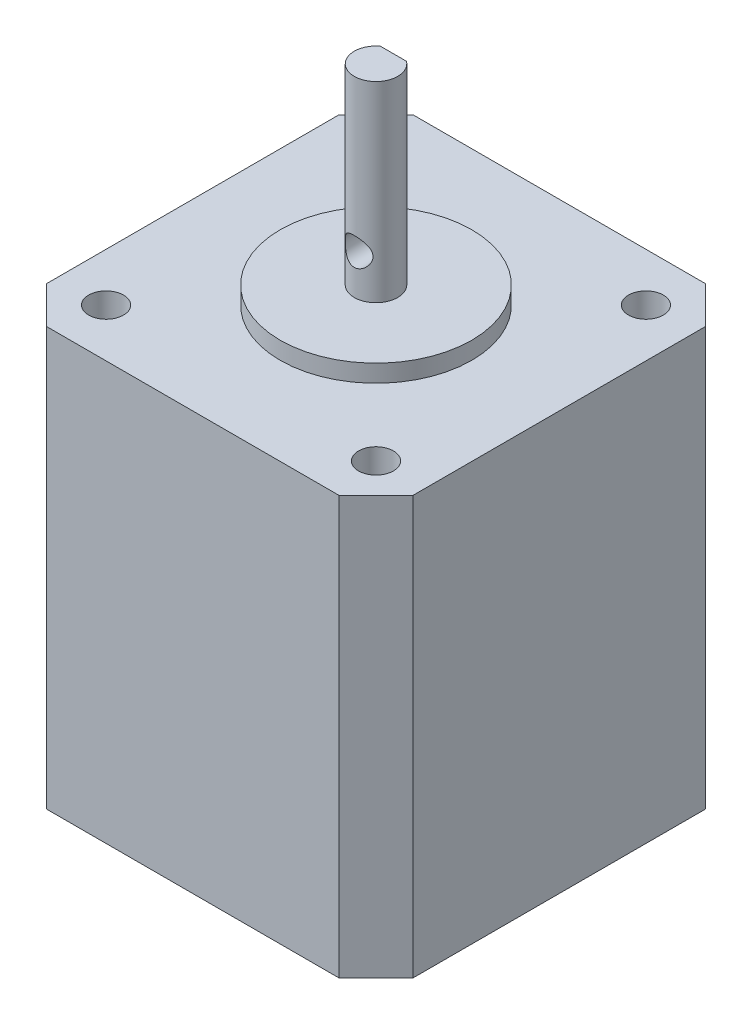
from build123d import *

# Parameters (mm, degrees)
BOSS_EXTRUDE1_DEPTH = 48
SKETCH2_R           = 2
CUT_EXTRUDE1_DEPTH  = 48
SKETCH3_R           = 11
BOSS_EXTRUDE2_DEPTH = 2
SKETCH4_R           = 2.5
BOSS_EXTRUDE3_DEPTH = 22
CUT_EXTRUDE2_START  = -15
CUT_EXTRUDE2_DEPTH  = 15
SKETCH6_R           = 1.5875
CUT_EXTRUDE5_DEPTH  = 79.623819546
BOSS_EXTRUDE4_START = 10
SKETCH7_R           = 2.5
BOSS_EXTRUDE4_DEPTH = 10
SKETCH8_R           = 0.75
CUT_EXTRUDE6_DEPTH  = 10


with BuildPart() as part:
    # Sketch1 → Boss-Extrude1 (new body)
    with BuildSketch(Plane(origin=(0, 0, 0), x_dir=(1, 0, 0), z_dir=(0, 1, 0))):
        Polygon((16.807359313, -21.05), (21.05, -16.807359313), (21.05, 16.807359313), (16.807359313, 21.05), (-16.807359313, 21.05), (-21.05, 16.807359313), (-21.05, -16.807359313), (-16.807359313, -21.05), align=None)
    extrude(amount=BOSS_EXTRUDE1_DEPTH)

    # Sketch2 → Cut-Extrude1 (cut)
    with BuildSketch(Plane(origin=(0, 48, 0), x_dir=(1, 0, 0), z_dir=(0, 1, 0))):
        with Locations(Location((-15.5, 15.5, 0), (0, 0, 270))):
            Circle(SKETCH2_R)
        with Locations(Location((15.5, 15.5, 0), (0, 0, 90))):
            Circle(SKETCH2_R)
        with Locations(Location((15.5, -15.5, 0), (0, 0, 270))):
            Circle(SKETCH2_R)
        with Locations(Location((-15.5, -15.5, 0), (0, 0, 90))):
            Circle(SKETCH2_R)
    extrude(amount=-CUT_EXTRUDE1_DEPTH, mode=Mode.SUBTRACT)

    # Sketch3 → Boss-Extrude2 (add)
    with BuildSketch(Plane(origin=(0, 48, 0), x_dir=(1, 0, 0), z_dir=(0, 1, 0))):
        with Locations(Location((0, 0, 0), (0, 0, 90))):
            Circle(SKETCH3_R)
    extrude(amount=BOSS_EXTRUDE2_DEPTH)

    # Sketch4 → Boss-Extrude3 (add)
    with BuildSketch(Plane(origin=(0, 50, 0), x_dir=(1, 0, 0), z_dir=(0, 1, 0))):
        with Locations(Location((0, 0, 0), (0, 0, 270))):
            Circle(SKETCH4_R)
    extrude(amount=BOSS_EXTRUDE3_DEPTH)

    # Sketch5 → Cut-Extrude2 (cut)
    with BuildSketch(Plane(origin=(0, 72, 0), x_dir=(1, 0, 0), z_dir=(0, 1, 0)).offset(CUT_EXTRUDE2_START)):
        with BuildLine():
            Line((-1.5, 2), (1.5, 2))
            ThreePointArc((1.5, 2), (0, 2.5), (-1.5, 2))
        make_face()
    extrude(amount=CUT_EXTRUDE2_DEPTH, mode=Mode.SUBTRACT)

    # Sketch6 → Cut-Extrude5 (cut, through all)
    with BuildSketch(Plane(origin=(0, 0, -2.5), x_dir=(-1, 0, 0), z_dir=(0, 0, -1))):
        with Locations((0, 54.5875)):
            Circle(SKETCH6_R)
    extrude(amount=-CUT_EXTRUDE5_DEPTH, mode=Mode.SUBTRACT)

    # Sketch7 → Boss-Extrude4 (add)
    with BuildSketch(Plane.XZ.offset(BOSS_EXTRUDE4_START)):
        with Locations(Location((0, 0, 0), (0, 0, 233.130102354))):
            Circle(SKETCH7_R)
    extrude(amount=-BOSS_EXTRUDE4_DEPTH)

    # Sketch8 → Cut-Extrude6 (cut)
    with BuildSketch(Plane.XZ.offset(10)):
        with Locations(Location((0, 0, 0), (0, 0, 270))):
            Circle(SKETCH8_R)
    extrude(amount=-CUT_EXTRUDE6_DEPTH, mode=Mode.SUBTRACT)


solid = part.part
